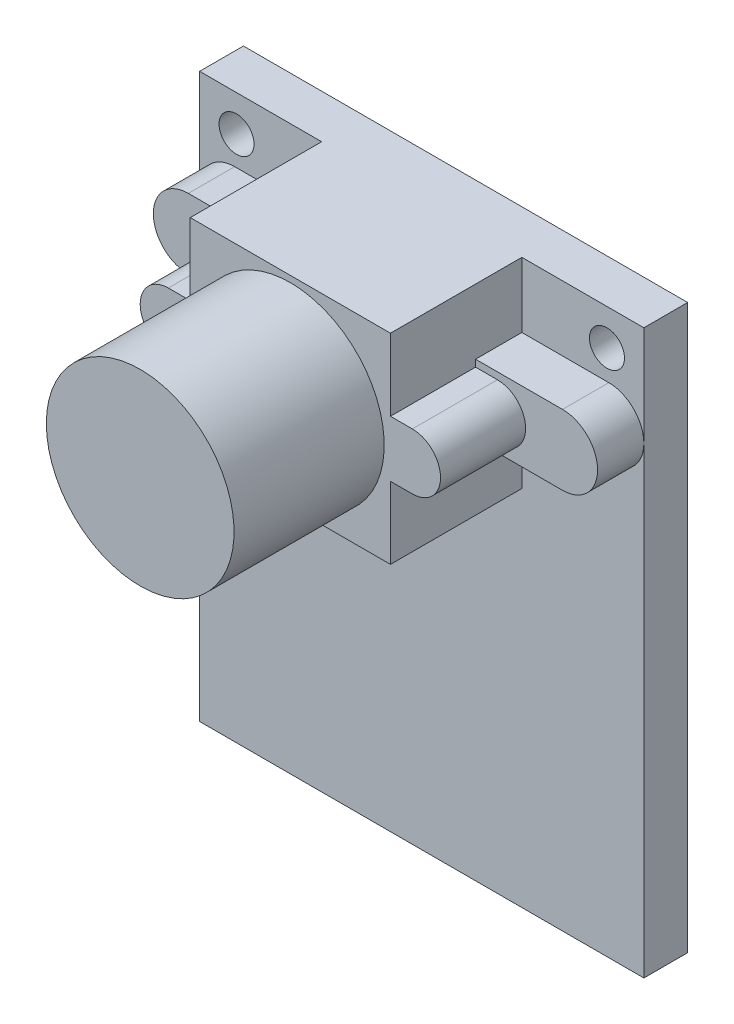
from build123d import *

# Parameters (mm, degrees)
SKETCH_4_W          = 35.5
SKETCH_4_H          = 45
EXTRUDE_2_DEPTH     = 3.5
EXTRUDE_START       = -3.5
SKETCH_5_W          = 16
SKETCH_5_H          = 4.5
SKETCH_5_H_2        = 5.75
EXTRUDE_3_DEPTH     = 14
EXTRUDE_4_DEPTH     = 7.2
EXTRUDE_START_2     = -14
SKETCH_7_R          = 7.5
EXTRUDE_5_DEPTH     = 26
CUT_EXTRUDE_1_REACH = 40.695
SKETCH_8_R          = 1.4


with BuildPart() as part:
    # 草图4 → 凸台-拉伸2 (new body)
    with BuildSketch(Plane.XY):
        Rectangle(SKETCH_4_W, SKETCH_4_H)
    extrude(amount=EXTRUDE_2_DEPTH)

    # 草图5 → 凸台-拉伸3 (add)
    with BuildSketch(Plane.XY.offset(3.5).offset(EXTRUDE_START)):
        with BuildLine():
            Line((-8, 12.25), (-8, 16.75))
            Line((-8, 16.75), (-9.75, 16.75))
            ThreePointArc((-9.75, 16.75), (-12, 14.5), (-9.75, 12.25))
            Line((-9.75, 12.25), (-8, 12.25))
        make_face()
        with Locations((0, 14.5)):
            Rectangle(SKETCH_5_W, SKETCH_5_H)
        with Locations((0, 19.625)):
            Rectangle(SKETCH_5_W, SKETCH_5_H_2)
        with BuildLine():
            Line((9.75, 16.75), (8, 16.75))
            Line((8, 16.75), (8, 12.25))
            Line((8, 12.25), (9.75, 12.25))
            ThreePointArc((9.75, 12.25), (12, 14.5), (9.75, 16.75))
        make_face()
        with Locations((0, 9.375)):
            Rectangle(SKETCH_5_W, SKETCH_5_H_2)
    extrude(amount=EXTRUDE_3_DEPTH)

    # 草图6 → 凸台-拉伸4 (add)
    with BuildSketch(Plane.XY.offset(3.5).offset(EXTRUDE_START)):
        with BuildLine():
            Line((-14.95, 17.3), (14.95, 17.3))
            ThreePointArc((14.95, 17.3), (17.75, 14.5), (14.95, 11.7))
            Line((14.95, 11.7), (-14.95, 11.7))
            ThreePointArc((-14.95, 11.7), (-17.75, 14.5), (-14.95, 17.3))
        make_face()
    extrude(amount=EXTRUDE_4_DEPTH)

    # 草图7 → 凸台-拉伸5 (add)
    with BuildSketch(Plane.XY.offset(14).offset(EXTRUDE_START_2)):
        with Locations(Location((0, 14.5, 0), (0, 0, 180))):
            Circle(SKETCH_7_R)
    extrude(amount=EXTRUDE_5_DEPTH)

    # 草图8 → 切除-拉伸1 (cut, up to next)
    with BuildSketch(Plane(origin=(0, 0, 0), x_dir=(-1, 0, 0), z_dir=(0, 0, -1)), mode=Mode.PRIVATE) as cut_extrude_1_sk1:
        with Locations((-14.8, 19.626575336)):
            Circle(SKETCH_8_R)
    cut_extrude_1_tool1 = extrude(cut_extrude_1_sk1.sketch, amount=-CUT_EXTRUDE_1_REACH, mode=Mode.PRIVATE) & part.part
    # 草图8 → 切除-拉伸1 (cut, up to next)
    with BuildSketch(Plane(origin=(0, 0, 0), x_dir=(-1, 0, 0), z_dir=(0, 0, -1)), mode=Mode.PRIVATE) as cut_extrude_1_sk2:
        with Locations(Location((14.8, 19.626575336, 0), (0, 0, 180))):
            Circle(SKETCH_8_R)
    cut_extrude_1_tool2 = extrude(cut_extrude_1_sk2.sketch, amount=-CUT_EXTRUDE_1_REACH, mode=Mode.PRIVATE) & part.part
    add(cut_extrude_1_tool1.solids().sort_by_distance((14.8, 19.626575, 0))[0], mode=Mode.SUBTRACT)
    add(cut_extrude_1_tool2.solids().sort_by_distance((-14.8, 19.626575, 0))[0], mode=Mode.SUBTRACT)


solid = part.part
